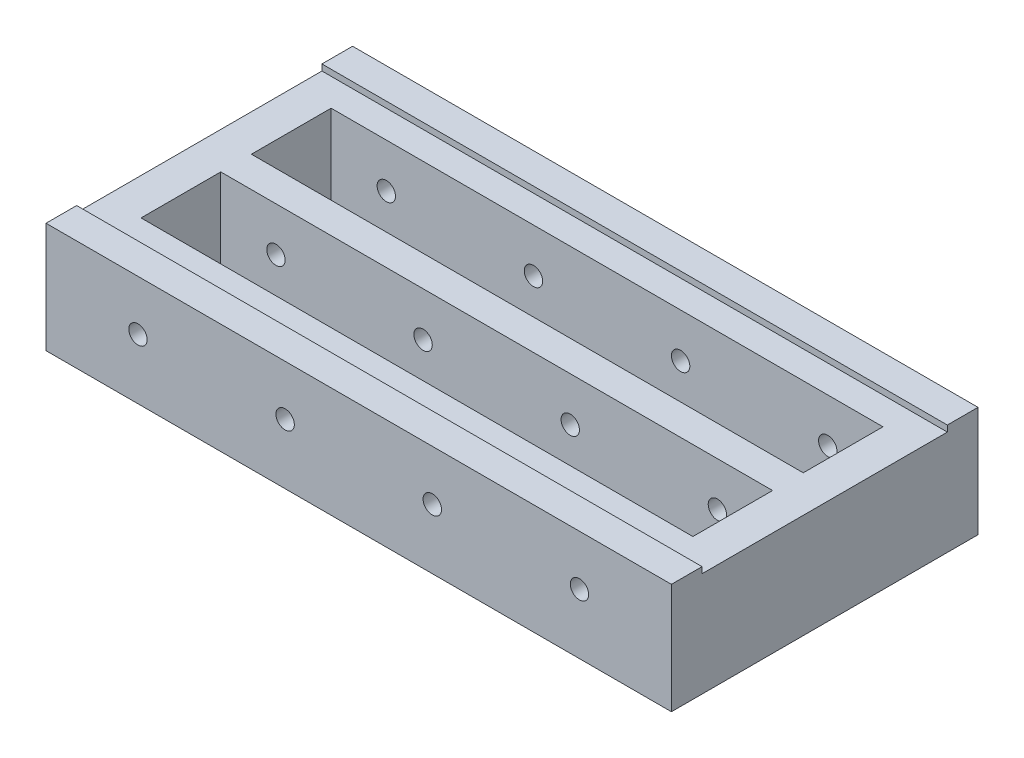
from build123d import *

# Parameters (mm, degrees)
SKETCH_1_W             = 51
SKETCH_1_H             = 25
SKETCH_1_W_2           = 9
SKETCH_1_H_2           = 6.5
EXTRUDE_1_DEPTH        = 9
SKETCH_2_W             = 51
SKETCH_2_H             = 20
CUT_EXTRUDE_1_DEPTH    = 0.5
SKETCH_3_R             = 0.75
CUT_EXTRUDE_2_DEPTH    = 31.336652749
PATTERN_LINEAR_1_COUNT = 4
PATTERN_LINEAR_1_PITCH = 12
SKETCH_4_W             = 45
SKETCH_4_H             = 6.5
CUT_EXTRUDE_3_DEPTH    = 30.643717716


with BuildPart() as part:
    # 草图1 → 凸台-拉伸1 (new body)
    with BuildSketch(Plane(origin=(0, 0, 0), x_dir=(1, 0, 0), z_dir=(0, 1, 0))):
        Rectangle(SKETCH_1_W, SKETCH_1_H)
        with Locations((-18, 4.5)):
            Rectangle(SKETCH_1_W_2, SKETCH_1_H_2, mode=Mode.SUBTRACT)
        with Locations((-18, -4.5)):
            Rectangle(SKETCH_1_W_2, SKETCH_1_H_2, mode=Mode.SUBTRACT)
        with Locations((-6, 4.5)):
            Rectangle(SKETCH_1_W_2, SKETCH_1_H_2, mode=Mode.SUBTRACT)
        with Locations((-6, -4.5)):
            Rectangle(SKETCH_1_W_2, SKETCH_1_H_2, mode=Mode.SUBTRACT)
        with Locations((6, 4.5)):
            Rectangle(SKETCH_1_W_2, SKETCH_1_H_2, mode=Mode.SUBTRACT)
        with Locations((6, -4.5)):
            Rectangle(SKETCH_1_W_2, SKETCH_1_H_2, mode=Mode.SUBTRACT)
        with Locations((18, 4.5)):
            Rectangle(SKETCH_1_W_2, SKETCH_1_H_2, mode=Mode.SUBTRACT)
        with Locations((18, -4.5)):
            Rectangle(SKETCH_1_W_2, SKETCH_1_H_2, mode=Mode.SUBTRACT)
    extrude(amount=EXTRUDE_1_DEPTH)

    # 草图2 → 切除-拉伸1 (cut)
    with BuildSketch(Plane(origin=(0, 9, 0), x_dir=(1, 0, 0), z_dir=(0, 1, 0))):
        Rectangle(SKETCH_2_W, SKETCH_2_H)
    extrude(amount=-CUT_EXTRUDE_1_DEPTH, mode=Mode.SUBTRACT)

    # 草图3 → 切除-拉伸2 (cut, symmetric)
    with BuildSketch(Plane.XY.offset(1.25)):
        with Locations((-18, 4.9)):
            Circle(SKETCH_3_R)
    cut_extrude_2 = extrude(amount=CUT_EXTRUDE_2_DEPTH, both=True, mode=Mode.SUBTRACT)

    # 阵列(线性)1: 切除-拉伸2 ×4
    with Locations(*[(i * PATTERN_LINEAR_1_PITCH, 0, 0) for i in range(1, PATTERN_LINEAR_1_COUNT)]):
        add(cut_extrude_2, mode=Mode.SUBTRACT)

    # 草图4 → 切除-拉伸3 (cut, through all)
    with BuildSketch(Plane(origin=(0, 8.5, 0), x_dir=(1, 0, 0), z_dir=(0, 1, 0))):
        with Locations((0, 4.5)):
            Rectangle(SKETCH_4_W, SKETCH_4_H)
        with Locations((0, -4.5)):
            Rectangle(SKETCH_4_W, SKETCH_4_H)
    extrude(amount=-CUT_EXTRUDE_3_DEPTH, mode=Mode.SUBTRACT)


solid = part.part
